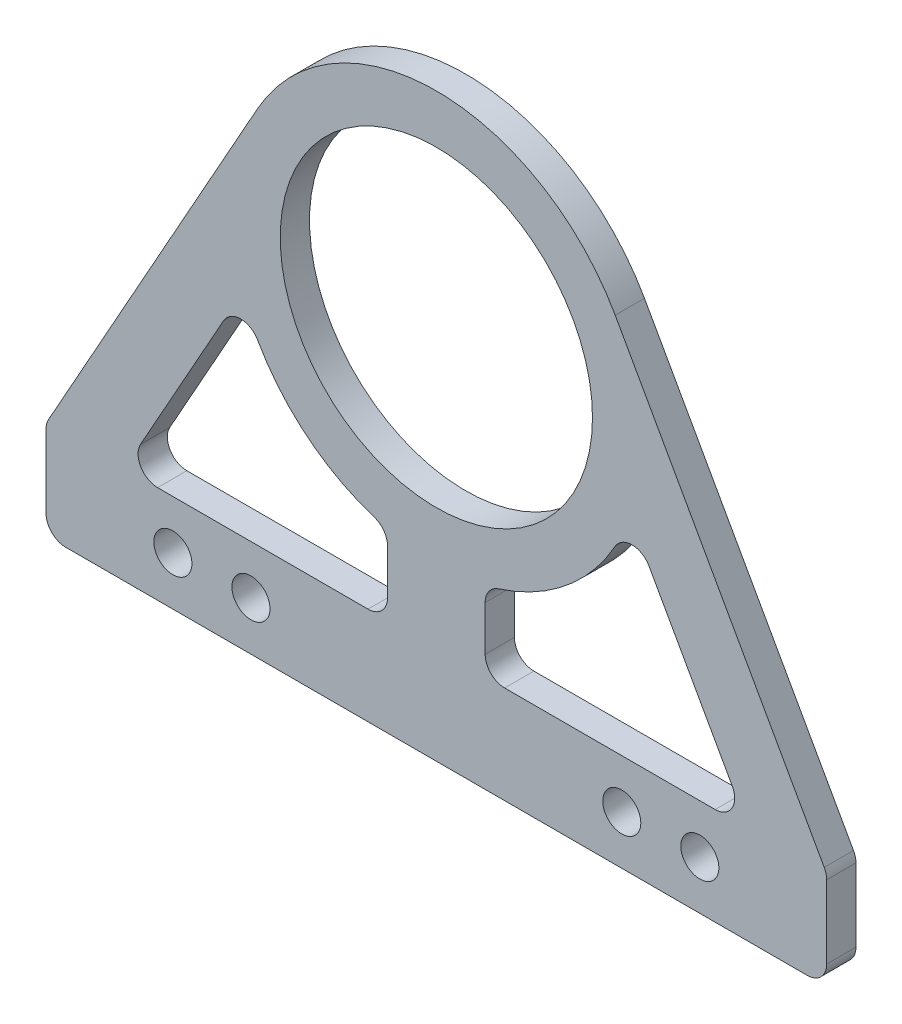
from build123d import *

# Parameters (mm, degrees)
SKETCH_1_R          = 16
SKETCH_1_R_2        = 1.95
EXTRUDE_1_DEPTH     = 3
CUT_EXTRUDE_1_DEPTH = 56.599010783
FILLET_1_R          = 2


with BuildPart() as part:
    # 草图1 → 凸台-拉伸1 (new body)
    with BuildSketch(Plane.XY):
        with BuildLine():
            Line((-40, -28.5), (-40, -38.5))
            Line((-40, -38.5), (40, -38.5))
            Line((40, -38.5), (40, -28.5))
            Line((40, -28.5), (18.328389928, 10.250371829))
            ThreePointArc((18.328389928, 10.250371829), (0, 21), (-18.328389928, 10.250371829))
            Line((-18.328389928, 10.250371829), (-40, -28.5))
        make_face()
        Circle(SKETCH_1_R, mode=Mode.SUBTRACT)
        with Locations((27, -33.5)):
            Circle(SKETCH_1_R_2, mode=Mode.SUBTRACT)
        with Locations((19, -33.5)):
            Circle(SKETCH_1_R_2, mode=Mode.SUBTRACT)
        with Locations((-27, -33.5)):
            Circle(SKETCH_1_R_2, mode=Mode.SUBTRACT)
        with Locations((-19, -33.5)):
            Circle(SKETCH_1_R_2, mode=Mode.SUBTRACT)
    extrude(amount=EXTRUDE_1_DEPTH)

    # 草图2 → 切除-拉伸1 (cut, through all)
    with BuildSketch(Plane.XY.offset(3)):
        with BuildLine():
            Line((-31.979655574, -28.5), (-5, -28.5))
            Line((-5, -28.5), (-5, -20.396078054))
            ThreePointArc((-5, -20.396078054), (-14.160497384, -15.507427699), (-19.859102687, -6.827594046))
            Line((-19.859102687, -6.827594046), (-31.979655574, -28.5))
        make_face()
        with BuildLine():
            Line((19.859102687, -6.827594046), (31.979655574, -28.5))
            Line((31.979655574, -28.5), (5, -28.5))
            Line((5, -28.5), (5, -20.396078054))
            ThreePointArc((5, -20.396078054), (14.160497384, -15.507427699), (19.859102687, -6.827594046))
        make_face()
    extrude(amount=-CUT_EXTRUDE_1_DEPTH, mode=Mode.SUBTRACT)

    # 圆角1
    fillet_1_edges = [part.edges().sort_by_distance(p)[0] for p in [
        (40, -28.5, 1.5),
        (40, -38.5, 1.5),
        (-40, -38.5, 1.5),
        (-40, -28.5, 1.5),
        (5, -20.396078054, 1.5),
        (19.859102687, -6.827594046, 1.5),
        (31.979655574, -28.5, 1.5),
        (5, -28.5, 1.5),
        (-31.979655574, -28.5, 1.5),
        (-19.859102687, -6.827594046, 1.5),
        (-5, -20.396078054, 1.5),
        (-5, -28.5, 1.5),
    ]]
    fillet(fillet_1_edges, radius=FILLET_1_R)


solid = part.part
